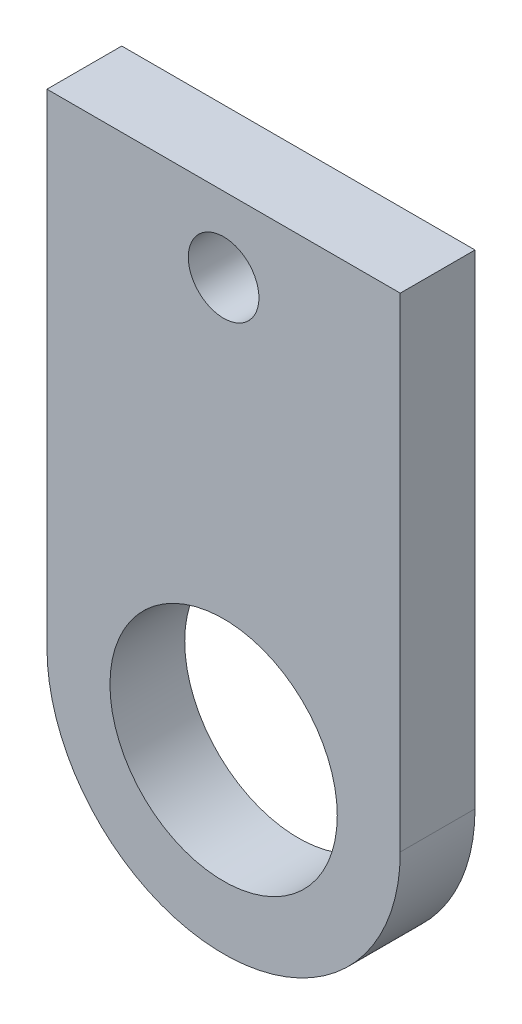
from build123d import *

# Parameters (mm, degrees)
SKETCH1_R           = 4.826
SKETCH1_R_2         = 1.5
BOSS_EXTRUDE1_DEPTH = 3.175


with BuildPart() as part:
    # Sketch1 → Boss-Extrude1 (new body)
    with BuildSketch(Plane.XY):
        with BuildLine():
            Line((-69.335466426, 27.169267575), (-54.335466426, 27.169267575))
            Line((-54.335466426, 27.169267575), (-54.335466426, 6.619267575))
            ThreePointArc((-54.335466426, 6.619267575), (-61.835466426, -0.880732425), (-69.335466426, 6.619267575))
            Line((-69.335466426, 6.619267575), (-69.335466426, 27.169267575))
        make_face()
        with Locations((-61.835466426, 6.619267575)):
            Circle(SKETCH1_R, mode=Mode.SUBTRACT)
        with Locations((-61.835466426, 23.994267575)):
            Circle(SKETCH1_R_2, mode=Mode.SUBTRACT)
    extrude(amount=BOSS_EXTRUDE1_DEPTH)


solid = part.part
